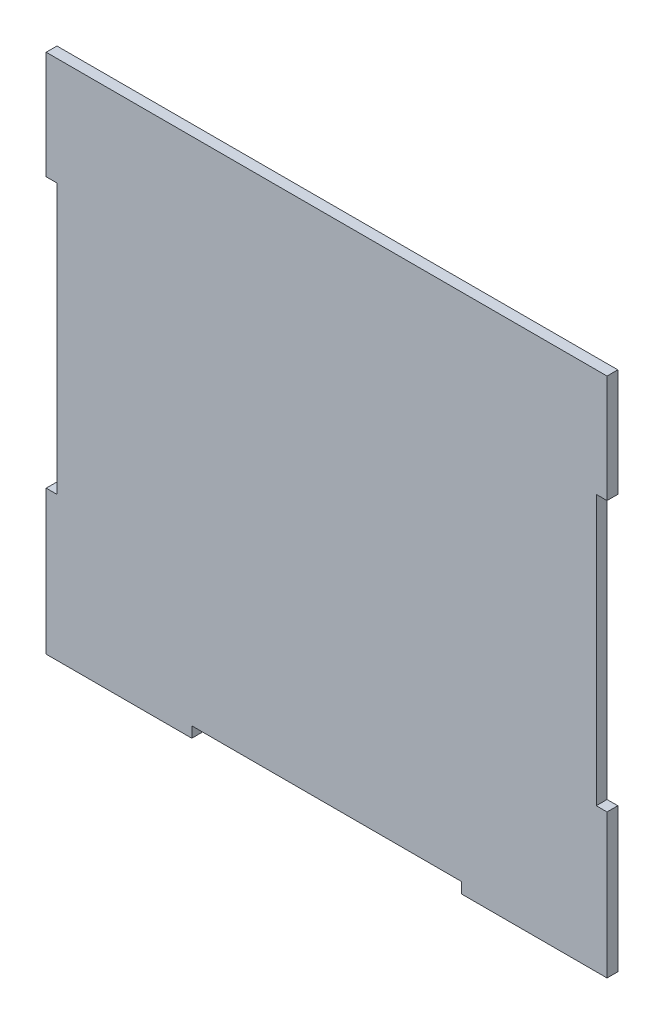
from build123d import *

# Parameters (mm, degrees)
SALIENTE_EXTRUIR1_DEPTH = 3


with BuildPart() as part:
    # Croquis1 → Saliente-Extruir1 (new body)
    with BuildSketch(Plane.XY):
        Polygon((0, 115), (0, 145), (156, 145), (156, 115), (153, 115), (153, 40), (156, 40), (156, 0), (115.5, 0), (115.5, 3), (40.5, 3), (40.5, 0), (0, 0), (0, 40), (3, 40), (3, 115), align=None)
    extrude(amount=SALIENTE_EXTRUIR1_DEPTH)


solid = part.part
